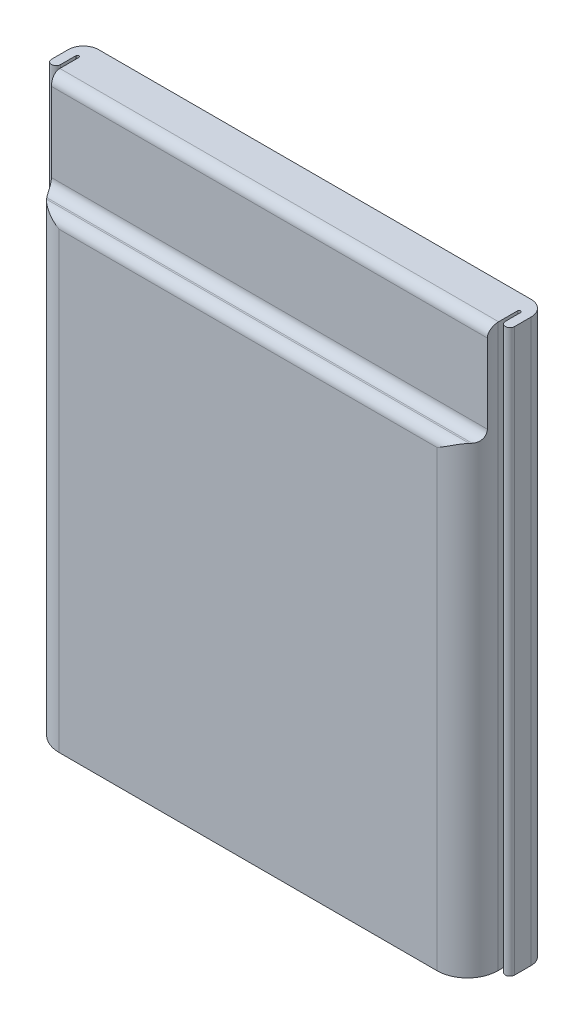
from build123d import *

# Parameters (mm, degrees)
EXTRUDE_1_DEPTH                 = 18.5
CUT_EXTRUDE_1_REACH             = 26.376
CUT_EXTRUDE_1_DIRECTION_2_REACH = 26.376


with BuildPart() as part:
    # Эскиз1 → Бобышка-Вытянуть1 (new, symmetric)
    with BuildSketch(Plane(origin=(0, 0, 0), x_dir=(1, 0, 0), z_dir=(0, 1, 0))):
        with BuildLine():
            Line((-14.25, 0), (14.25, 0))
            ThreePointArc((14.25, 0), (14.957106781, -0.292893219), (15.25, -1))
            Line((15.25, -1), (15.25, -2.1))
            ThreePointArc((15.25, -2.1), (14.95, -2.4), (14.65, -2.1))
            Line((14.65, -2.1), (14.65, -1.1))
            ThreePointArc((14.65, -1.1), (14.55, -1), (14.45, -1.1))
            Line((14.45, -1.1), (14.45, -2.4))
            ThreePointArc((14.45, -2.4), (13.864213562, -3.814213562), (12.45, -4.4))
            Line((12.45, -4.4), (-12.45, -4.4))
            ThreePointArc((-12.45, -4.4), (-13.864213562, -3.814213562), (-14.45, -2.4))
            Line((-14.45, -2.4), (-14.45, -1.1))
            ThreePointArc((-14.45, -1.1), (-14.55, -1), (-14.65, -1.1))
            Line((-14.65, -1.1), (-14.65, -2.1))
            ThreePointArc((-14.65, -2.1), (-14.95, -2.4), (-15.25, -2.1))
            Line((-15.25, -2.1), (-15.25, -1))
            ThreePointArc((-15.25, -1), (-14.957106781, -0.292893219), (-14.25, 0))
        make_face()
    extrude(amount=EXTRUDE_1_DEPTH, both=True)

    # Эскиз2 → Вырез-Вытянуть1 (cut, up to next)
    with BuildSketch(Plane(origin=(0, 0, 0), x_dir=(0, 0, -1), z_dir=(1, 0, 0)), mode=Mode.PRIVATE) as cut_extrude_1_sk1:
        with BuildLine():
            Line((-3, 17.85), (-3, 12.65))
            ThreePointArc((-3, 12.65), (-3.190380592, 12.190380592), (-3.65, 12))
            Line((-3.65, 12), (-3.75, 12))
            ThreePointArc((-3.75, 12), (-4.209619408, 11.809619408), (-4.4, 11.35))
            Line((-4.4, 11.35), (-4.4, 18.5))
            Line((-4.4, 18.5), (-2.35, 18.5))
            ThreePointArc((-2.35, 18.5), (-2.809619408, 18.309619408), (-3, 17.85))
        make_face()
    cut_extrude_1_tool1 = extrude(cut_extrude_1_sk1.sketch, amount=-CUT_EXTRUDE_1_REACH, mode=Mode.PRIVATE) & part.part
    add(cut_extrude_1_tool1.solids().sort_by_distance((0, 15.277765, 3.702609))[0], mode=Mode.SUBTRACT)

    # Эскиз2 → Вырез-Вытянуть1 direction 2 (cut, up to next)
    with BuildSketch(Plane(origin=(0, 0, 0), x_dir=(0, 0, -1), z_dir=(1, 0, 0)), mode=Mode.PRIVATE) as cut_extrude_1_direction_2_sk1:
        with BuildLine():
            Line((-3, 17.85), (-3, 12.65))
            ThreePointArc((-3, 12.65), (-3.190380592, 12.190380592), (-3.65, 12))
            Line((-3.65, 12), (-3.75, 12))
            ThreePointArc((-3.75, 12), (-4.209619408, 11.809619408), (-4.4, 11.35))
            Line((-4.4, 11.35), (-4.4, 18.5))
            Line((-4.4, 18.5), (-2.35, 18.5))
            ThreePointArc((-2.35, 18.5), (-2.809619408, 18.309619408), (-3, 17.85))
        make_face()
    cut_extrude_1_direction_2_tool1 = extrude(cut_extrude_1_direction_2_sk1.sketch, amount=CUT_EXTRUDE_1_DIRECTION_2_REACH, mode=Mode.PRIVATE) & part.part
    add(cut_extrude_1_direction_2_tool1.solids().sort_by_distance((0, 15.277765, 3.702609))[0], mode=Mode.SUBTRACT)


solid = part.part
